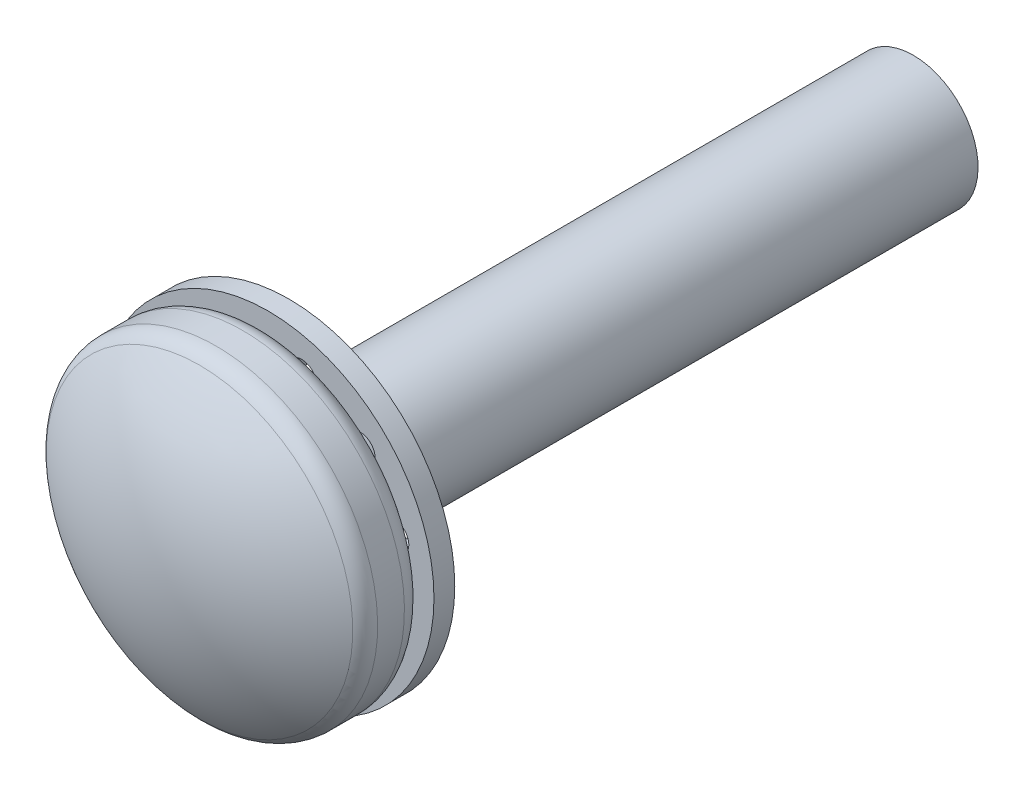
from build123d import *

# Parameters (mm, degrees)
SKETCH3_W          = 19.05
SKETCH3_H          = 1.897444252
SKETCH8_W          = 3.3782
SKETCH8_H          = 4.7371
SKETCH18_R         = 4.8641
SKETCH18_R_2       = 3.380772126
EXTRUDE1_DEPTH     = 0.6096
CUT_EXTRUDE2_DEPTH = 20.558681507
CIRPATTERN2_COUNT  = 12
SKETCH30_W         = 0.9896825
SKETCH30_H         = 0.6096
EXTRUDE5_DEPTH     = 0.0508
CIRPATTERN8_COUNT  = 12


with BuildPart() as part:
    # Sketch3 → Revolve1 (revolve)
    with BuildSketch(Plane(origin=(0, 0, 0), x_dir=(0, 0, -1), z_dir=(1, 0, 0))):
        with Locations((-9.525, 0.948722126)):
            Rectangle(SKETCH3_W, SKETCH3_H)
    revolve(axis=Axis((0, 0, 0), (0, 0, 1)))

    # Sketch8 → Revolve2 (revolve)
    with BuildSketch(Plane(origin=(0, 0, 0), x_dir=(0, 0, -1), z_dir=(1, 0, 0))):
        with Locations((-20.7391, 2.36855)):
            Rectangle(SKETCH8_W, SKETCH8_H)
    revolve(axis=Axis((0, 0, 0), (0, 0, 1)))

    # Sketch11 → Cut-Revolve3 (revolve, cut)
    with BuildSketch(Plane(origin=(0, 0, 0), x_dir=(0, 0, -1), z_dir=(1, 0, 0))):
        with BuildLine():
            Line((-20.443130449, 4.7371), (-19.658076, 4.7371))
            ThreePointArc((-19.658076, 4.7371), (-19.228101337, 4.558998663), (-19.05, 4.129024))
            Line((-19.05, 4.129024), (-18.415, 4.129024))
            Line((-18.415, 4.129024), (-18.415, 5.3721))
            Line((-18.415, 5.3721), (-23.0632, 5.3721))
            Line((-23.0632, 5.3721), (-23.0632, 0))
            Line((-23.0632, 0), (-22.4282, 0))
            ThreePointArc((-22.4282, 0), (-22.043646213, 2.368662391), (-20.929487499, 4.494007892))
            ThreePointArc((-20.929487499, 4.494007892), (-20.714992985, 4.672942361), (-20.443130449, 4.7371))
        make_face()
    revolve(axis=Axis((0, 0, 22.4282), (0, 0, -1)), mode=Mode.SUBTRACT)


with BuildPart() as body_2:
    # Sketch18 → Extrude1 (new body)
    with BuildSketch(Plane.XY.offset(18.918698413)):
        Circle(SKETCH18_R)
        Circle(SKETCH18_R_2, mode=Mode.SUBTRACT)
    extrude(amount=-EXTRUDE1_DEPTH)

    # Sketch19 → Cut-Extrude2 (cut, through all)
    with BuildSketch(Plane(origin=(0, 0, 18.309098413), x_dir=(-1, 0, 0), z_dir=(0, 0, -1))):
        with BuildLine():
            Line((1.395327488, 3.527176728), (0, 0))
            Line((0, 0), (0.555199312, 3.752288394))
            ThreePointArc((0.555199312, 3.752288394), (1.101556503, 4.111064835), (1.395327488, 3.527176728))
        make_face()
    cut_extrude2 = extrude(amount=-CUT_EXTRUDE2_DEPTH, mode=Mode.SUBTRACT)

    # CirPattern2: Cut-Extrude2 ×12 about axis
    cirpattern2_axis = Axis((0, 0, 0), (0, 0, -1))
    for i in range(1, CIRPATTERN2_COUNT):
        add(cut_extrude2.rotate(cirpattern2_axis, i * 360 / CIRPATTERN2_COUNT), mode=Mode.SUBTRACT)


with BuildPart() as body_3:
    # Sketch25 → Loft4 section 0
    with BuildSketch(Plane(origin=(0, 3.34436127, 0), x_dir=(-1, 0, 0), z_dir=(0, 1, 0))):
        with BuildLine():
            Line((-0.49484125, 18.309098413), (0.49484125, 18.309098413))
            Line((0.49484125, 18.309098413), (0.49484125, 18.918698413))
            Line((0.49484125, 18.918698413), (-0.49484125, 18.918698413))
            Line((-0.49484125, 18.918698413), (-0.49484125, 18.309098413))
        make_face()
    # Sketch26 → Loft4 section 1
    with BuildSketch(Plane(origin=(0, 1.897444252, 0), x_dir=(-1, 0, 0), z_dir=(0, 1, 0))):
        with BuildLine():
            Line((-0.478067611, 18.493102689), (-0.230120954, 19.05))
            Line((-0.230120954, 19.05), (0.478067611, 18.734694136))
            Line((0.478067611, 18.734694136), (0.230120954, 18.177796825))
            Line((0.230120954, 18.177796825), (-0.478067611, 18.493102689))
        make_face()
    loft()


with BuildPart() as body_4:
    # Sketch30 → Extrude5 (new body)
    with BuildSketch(Plane(origin=(0, 3.34436127, 0), x_dir=(-1, 0, 0), z_dir=(0, 1, 0))):
        with Locations((0, 18.613898413)):
            Rectangle(SKETCH30_W, SKETCH30_H)
    extrude(amount=EXTRUDE5_DEPTH)


with BuildPart() as cirpattern8_1:
    # CirPattern8: pattern copy
    add(body_4.part.rotate(Axis((0, 0, 0), (0, 0, -1)), 1 * 360 / CIRPATTERN8_COUNT))


with BuildPart() as cirpattern8_2:
    # CirPattern8: pattern copy
    add(body_4.part.rotate(Axis((0, 0, 0), (0, 0, -1)), 2 * 360 / CIRPATTERN8_COUNT))


with BuildPart() as cirpattern8_3:
    # CirPattern8: pattern copy
    add(body_4.part.rotate(Axis((0, 0, 0), (0, 0, -1)), 3 * 360 / CIRPATTERN8_COUNT))


with BuildPart() as cirpattern8_4:
    # CirPattern8: pattern copy
    add(body_4.part.rotate(Axis((0, 0, 0), (0, 0, -1)), 4 * 360 / CIRPATTERN8_COUNT))


with BuildPart() as cirpattern8_5:
    # CirPattern8: pattern copy
    add(body_4.part.rotate(Axis((0, 0, 0), (0, 0, -1)), 5 * 360 / CIRPATTERN8_COUNT))


with BuildPart() as cirpattern8_6:
    # CirPattern8: pattern copy
    add(body_4.part.rotate(Axis((0, 0, 0), (0, 0, -1)), 6 * 360 / CIRPATTERN8_COUNT))


with BuildPart() as cirpattern8_7:
    # CirPattern8: pattern copy
    add(body_4.part.rotate(Axis((0, 0, 0), (0, 0, -1)), 7 * 360 / CIRPATTERN8_COUNT))


with BuildPart() as cirpattern8_8:
    # CirPattern8: pattern copy
    add(body_4.part.rotate(Axis((0, 0, 0), (0, 0, -1)), 8 * 360 / CIRPATTERN8_COUNT))


with BuildPart() as cirpattern8_9:
    # CirPattern8: pattern copy
    add(body_4.part.rotate(Axis((0, 0, 0), (0, 0, -1)), 9 * 360 / CIRPATTERN8_COUNT))


with BuildPart() as cirpattern8_10:
    # CirPattern8: pattern copy
    add(body_4.part.rotate(Axis((0, 0, 0), (0, 0, -1)), 10 * 360 / CIRPATTERN8_COUNT))


with BuildPart() as cirpattern8_11:
    # CirPattern8: pattern copy
    add(body_4.part.rotate(Axis((0, 0, 0), (0, 0, -1)), 11 * 360 / CIRPATTERN8_COUNT))


with BuildPart() as cirpattern8_12:
    # CirPattern8: pattern copy
    add(body_3.part.rotate(Axis((0, 0, 0), (0, 0, -1)), 1 * 360 / CIRPATTERN8_COUNT))


with BuildPart() as cirpattern8_13:
    # CirPattern8: pattern copy
    add(body_3.part.rotate(Axis((0, 0, 0), (0, 0, -1)), 2 * 360 / CIRPATTERN8_COUNT))


with BuildPart() as cirpattern8_14:
    # CirPattern8: pattern copy
    add(body_3.part.rotate(Axis((0, 0, 0), (0, 0, -1)), 3 * 360 / CIRPATTERN8_COUNT))


with BuildPart() as cirpattern8_15:
    # CirPattern8: pattern copy
    add(body_3.part.rotate(Axis((0, 0, 0), (0, 0, -1)), 4 * 360 / CIRPATTERN8_COUNT))


with BuildPart() as cirpattern8_16:
    # CirPattern8: pattern copy
    add(body_3.part.rotate(Axis((0, 0, 0), (0, 0, -1)), 5 * 360 / CIRPATTERN8_COUNT))


with BuildPart() as cirpattern8_17:
    # CirPattern8: pattern copy
    add(body_3.part.rotate(Axis((0, 0, 0), (0, 0, -1)), 6 * 360 / CIRPATTERN8_COUNT))


with BuildPart() as cirpattern8_18:
    # CirPattern8: pattern copy
    add(body_3.part.rotate(Axis((0, 0, 0), (0, 0, -1)), 7 * 360 / CIRPATTERN8_COUNT))


with BuildPart() as cirpattern8_19:
    # CirPattern8: pattern copy
    add(body_3.part.rotate(Axis((0, 0, 0), (0, 0, -1)), 8 * 360 / CIRPATTERN8_COUNT))


with BuildPart() as cirpattern8_20:
    # CirPattern8: pattern copy
    add(body_3.part.rotate(Axis((0, 0, 0), (0, 0, -1)), 9 * 360 / CIRPATTERN8_COUNT))


with BuildPart() as cirpattern8_21:
    # CirPattern8: pattern copy
    add(body_3.part.rotate(Axis((0, 0, 0), (0, 0, -1)), 10 * 360 / CIRPATTERN8_COUNT))


with BuildPart() as cirpattern8_22:
    # CirPattern8: pattern copy
    add(body_3.part.rotate(Axis((0, 0, 0), (0, 0, -1)), 11 * 360 / CIRPATTERN8_COUNT))


with BuildPart() as body_3_1:
    add(body_3.part)

    # Combine2: union body 4, CirPattern8_11, CirPattern8_10, CirPattern8_9, CirPattern8_8, CirPattern8_7, CirPattern8_6, CirPattern8_5, CirPattern8_4, CirPattern8_3, CirPattern8_2, CirPattern8_1, CirPattern8_22, CirPattern8_21, CirPattern8_20, CirPattern8_19, CirPattern8_18, CirPattern8_17, CirPattern8_16, CirPattern8_15, CirPattern8_14, CirPattern8_13, CirPattern8_12, body 2
    add(body_4.part)
    add(cirpattern8_11.part)
    add(cirpattern8_10.part)
    add(cirpattern8_9.part)
    add(cirpattern8_8.part)
    add(cirpattern8_7.part)
    add(cirpattern8_6.part)
    add(cirpattern8_5.part)
    add(cirpattern8_4.part)
    add(cirpattern8_3.part)
    add(cirpattern8_2.part)
    add(cirpattern8_1.part)
    add(cirpattern8_22.part)
    add(cirpattern8_21.part)
    add(cirpattern8_20.part)
    add(cirpattern8_19.part)
    add(cirpattern8_18.part)
    add(cirpattern8_17.part)
    add(cirpattern8_16.part)
    add(cirpattern8_15.part)
    add(cirpattern8_14.part)
    add(cirpattern8_13.part)
    add(cirpattern8_12.part)
    add(body_2.part)


solid = Compound([part.part, body_3_1.part])
